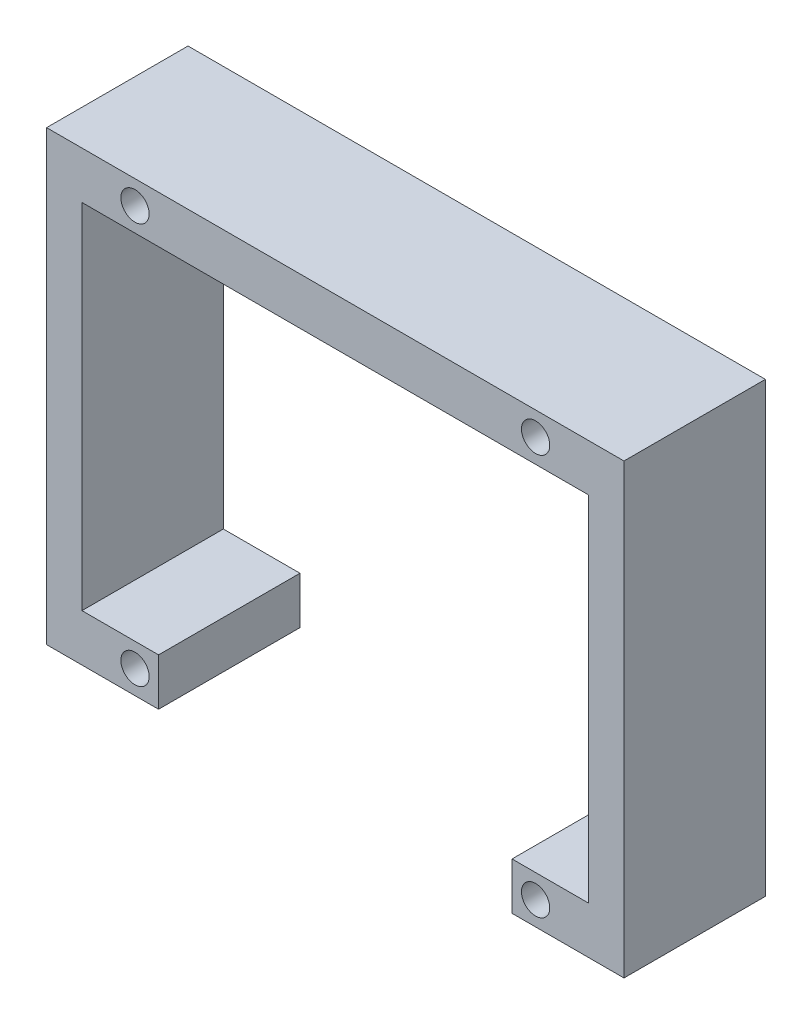
from build123d import *

# Parameters (mm, degrees)
SKETCH_1_R      = 1.2
EXTRUDE_1_DEPTH = 12


with BuildPart() as part:
    # 草图1 → 凸台-拉伸1 (new body)
    with BuildSketch(Plane.XY):
        Polygon((-15, -19), (-15, -15), (-21.5, -15), (-21.5, 15), (21.5, 15), (21.5, -15), (15, -15), (15, -19), (24.5, -19), (24.5, 19), (-24.5, 19), (-24.5, -19), align=None)
        with Locations((-17, 17)):
            Circle(SKETCH_1_R, mode=Mode.SUBTRACT)
        with Locations((17, 17)):
            Circle(SKETCH_1_R, mode=Mode.SUBTRACT)
        with Locations((-17, -17)):
            Circle(SKETCH_1_R, mode=Mode.SUBTRACT)
        with Locations((17, -17)):
            Circle(SKETCH_1_R, mode=Mode.SUBTRACT)
    extrude(amount=EXTRUDE_1_DEPTH)


solid = part.part
